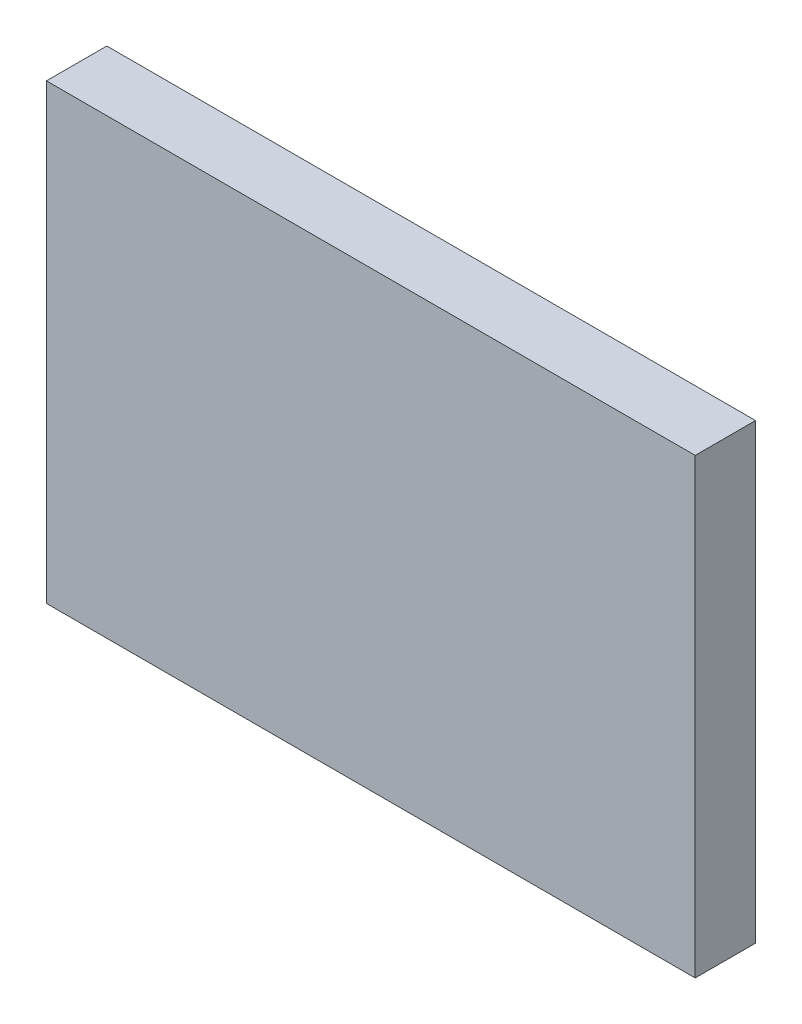
from build123d import *

# Parameters (mm, degrees)
CROQUIS1_W              = 43
CROQUIS1_H              = 30
SALIENTE_EXTRUIR1_DEPTH = 4


with BuildPart() as part:
    # Croquis1 → Saliente-Extruir1 (new body)
    with BuildSketch(Plane.XY):
        with Locations((21.5, -15)):
            Rectangle(CROQUIS1_W, CROQUIS1_H)
    extrude(amount=SALIENTE_EXTRUIR1_DEPTH)


solid = part.part
